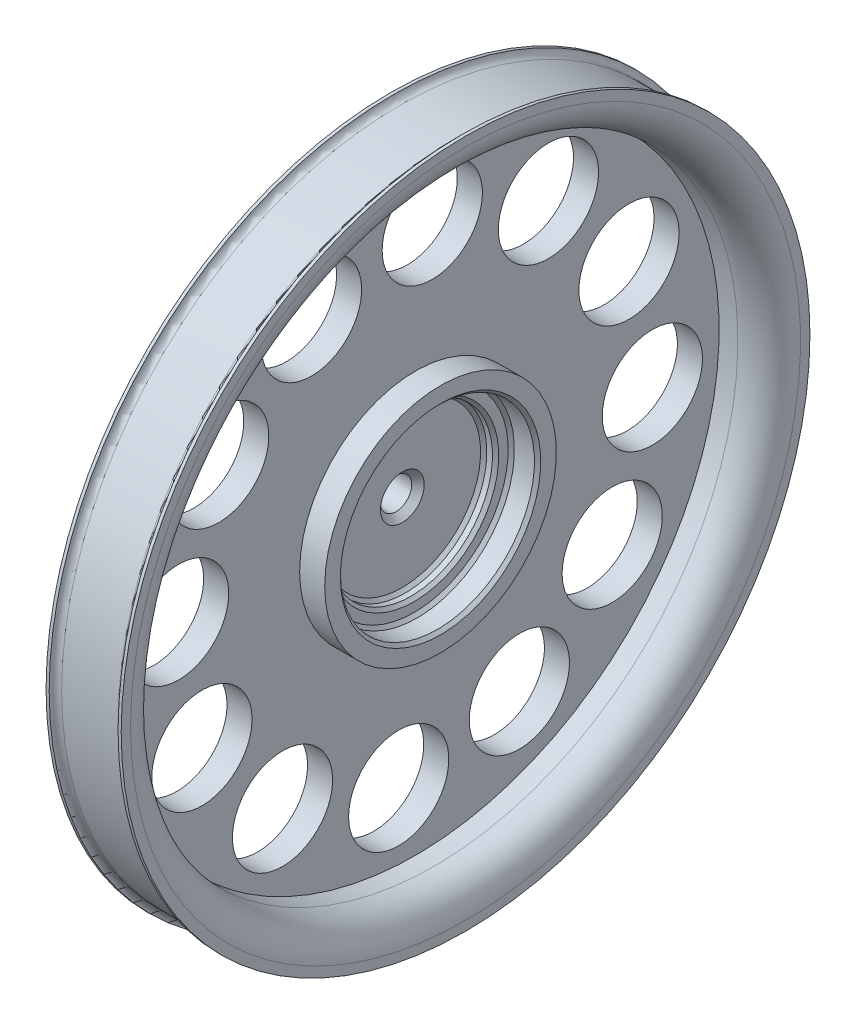
from build123d import *

# Parameters (mm, degrees)
SZKIC2_R                   = 2.5
WYTNIJ_WYCI_GNI_CIE1_DEPTH = 102.105666205
ZAOKR_GLENIE1_R            = 10
ZAOKR_GLENIE2_R            = 5
SFAZOWANIE1_SIZE           = 1
SFAZOWANIE2_SIZE           = 0.5
SFAZOWANIE3_SIZE           = 0.5
SZKIC3_R                   = 8
WYTNIJ_WYCI_GNI_CIE2_DEPTH = 100.811551129


with BuildPart() as part:
    # Szkic1 → Obrót1 (revolve)
    with BuildSketch(Plane.XY, mode=Mode.PRIVATE) as obr_t1_sk:
        with BuildLine():
            Line((0, 27.578244749), (0, 21.078244749))
            Line((0, 21.078244749), (-8, 21.078244749))
            Line((-8, 21.078244749), (-8, -8.921755251))
            Line((-8, -8.921755251), (-4, -8.921755251))
            Line((-4, -8.921755251), (-4, -11.921755251))
            Line((-4, -11.921755251), (-8.2, -11.921755251))
            Line((-8.2, -11.921755251), (-8.2, -14.421755251))
            Line((-8.2, -14.421755251), (-10.1, -14.421755251))
            Line((-10.1, -14.421755251), (-10.1, -27.421755251))
            Line((-10.1, -27.421755251), (-20.1, -27.421755251))
            Line((-20.1, -27.421755251), (-20.1, -14.421755251))
            Line((-20.1, -14.421755251), (-12, -3.992443519))
            Line((-12, -3.992443519), (-12, 27.578244749))
            Line((-12, 27.578244749), (-11.5, 27.578244749))
            ThreePointArc((-11.5, 27.578244749), (-11.207862875, 26.874632586), (-10.504874285, 26.580998091))
            Line((-10.504874285, 26.580998091), (-1.498959596, 26.580998091))
            ThreePointArc((-1.498959596, 26.580998091), (-0.793496456, 26.873284267), (-0.5, 27.578244749))
            Line((-0.5, 27.578244749), (0, 27.578244749))
        make_face()
    revolve(obr_t1_sk.sketch.rotate(Axis((-20.1, -27.421755251, 0), (1, 0, 0)), 90), axis=Axis((-20.1, -27.421755251, 0), (1, 0, 0)))

    # Szkic2 → Wytnij-wyciągnięcie1 (cut, through all)
    with BuildSketch(Plane.ZY.offset(20.1)):
        with Locations((0, -27.421755251)):
            Circle(SZKIC2_R)
    extrude(amount=-WYTNIJ_WYCI_GNI_CIE1_DEPTH, mode=Mode.SUBTRACT)

    # Zaokrąglenie1
    zaokr_glenie1_edges = [part.edges().sort_by_distance(p)[0] for p in [
        (-20.1, -27.421755251, -13),
        (-12, -27.421755251, -23.429311732),
    ]]
    fillet(zaokr_glenie1_edges, radius=ZAOKR_GLENIE1_R)

    # Zaokrąglenie2
    zaokr_glenie2_edges = [part.edges().sort_by_distance(p)[0] for p in [
        (0, -27.421755251, -48.5),
    ]]
    fillet(zaokr_glenie2_edges, radius=ZAOKR_GLENIE2_R)

    # Sfazowanie1
    sfazowanie1_edges = [part.edges().sort_by_distance(p)[0] for p in [
        (-10.1, -27.421755251, -2.5),
        (-20.1, -27.421755251, -2.5),
    ]]
    chamfer(sfazowanie1_edges, length=SFAZOWANIE1_SIZE)

    # Sfazowanie2
    sfazowanie2_edges = [part.edges().sort_by_distance(p)[0] for p in [
        (-8.2, -27.421755251, -13),
        (-10.1, -27.421755251, -13),
    ]]
    chamfer(sfazowanie2_edges, length=SFAZOWANIE2_SIZE)

    # Sfazowanie3
    sfazowanie3_edges = [part.edges().sort_by_distance(p)[0] for p in [
        (-4, -27.421755251, -15.5),
        (-8.2, -27.421755251, -15.5),
    ]]
    chamfer(sfazowanie3_edges, length=SFAZOWANIE3_SIZE)

    # Szkic3 → Wytnij-wyciągnięcie2 (cut, through all)
    with BuildSketch(Plane.ZY.offset(12)):
        with Locations((37.829338499, -24.741520982)):
            Circle(SZKIC3_R)
        with Locations((34.101285283, -44.015273535)):
            Circle(SZKIC3_R)
        with Locations((21.235820215, -58.842806265)):
            Circle(SZKIC3_R)
        with Locations((2.68023427, -65.25109375)):
            Circle(SZKIC3_R)
        with Locations((-16.593518284, -61.523040535)):
            Circle(SZKIC3_R)
        with Locations((-31.421051014, -48.657575467)):
            Circle(SZKIC3_R)
        with Locations((-37.829338499, -30.101989521)):
            Circle(SZKIC3_R)
        with Locations((-34.101285283, -10.828236968)):
            Circle(SZKIC3_R)
        with Locations((-21.235820215, 3.999295762)):
            Circle(SZKIC3_R)
        with Locations((-2.68023427, 10.407583248)):
            Circle(SZKIC3_R)
        with Locations((16.593518284, 6.679530032)):
            Circle(SZKIC3_R)
        with Locations((31.421051014, -6.185935036)):
            Circle(SZKIC3_R)
    extrude(amount=-WYTNIJ_WYCI_GNI_CIE2_DEPTH, mode=Mode.SUBTRACT)


solid = part.part
